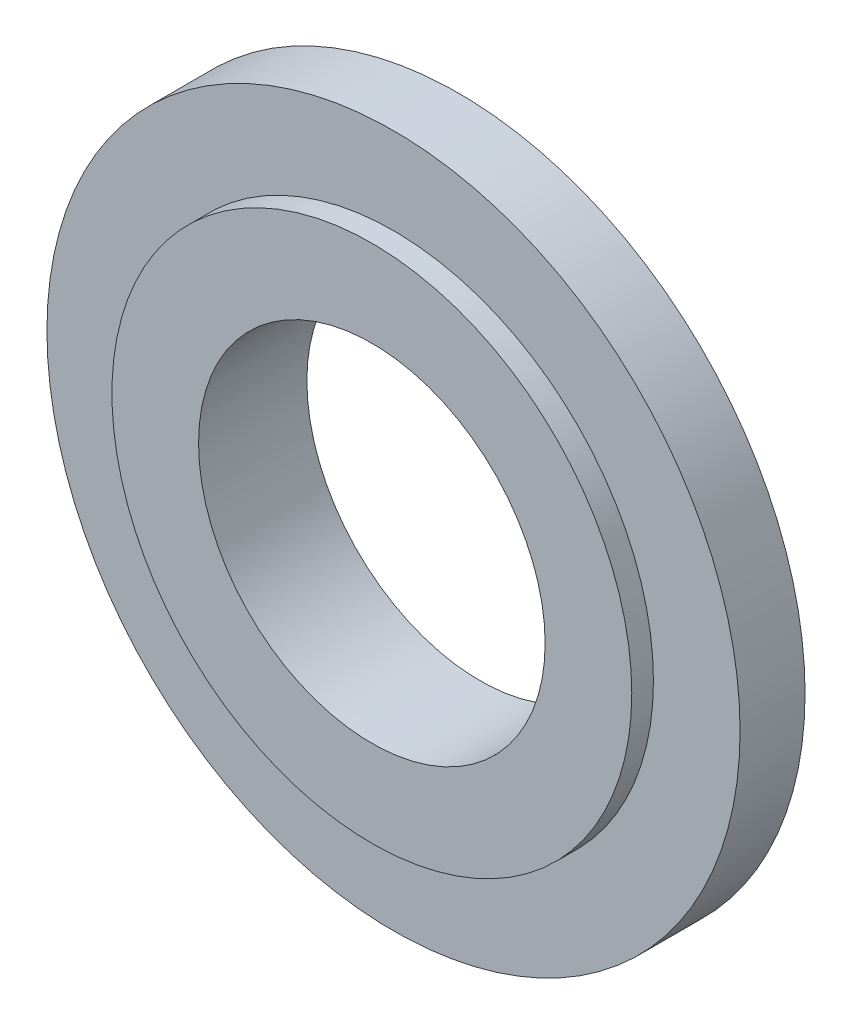
from build123d import *

# Parameters (mm, degrees)
SKETCH_1_R      = 8
SKETCH_1_R_2    = 4
EXTRUDE_1_DEPTH = 1.5
SKETCH_2_R      = 6
SKETCH_2_R_2    = 4
EXTRUDE_2_DEPTH = 0.5
EXTRUDE_START   = 0.5
SKETCH_3_R      = 6
SKETCH_3_R_2    = 4
EXTRUDE_3_DEPTH = 0.5


with BuildPart() as part:
    # Эскиз1 → Бобышка-Вытянуть1 (new body)
    with BuildSketch(Plane.XY):
        Circle(SKETCH_1_R)
        Circle(SKETCH_1_R_2, mode=Mode.SUBTRACT)
    extrude(amount=EXTRUDE_1_DEPTH)

    # Эскиз2 → Бобышка-Вытянуть2 (add)
    with BuildSketch(Plane.XY.offset(1.5)):
        Circle(SKETCH_2_R)
        Circle(SKETCH_2_R_2, mode=Mode.SUBTRACT)
    extrude(amount=EXTRUDE_2_DEPTH)

    # Эскиз3 → Бобышка-Вытянуть3 (add)
    with BuildSketch(Plane(origin=(0, 0, 0), x_dir=(-1, 0, 0), z_dir=(0, 0, -1)).offset(EXTRUDE_START)):
        with Locations(Location((0, 0, 0), (0, 0, 180))):
            Circle(SKETCH_3_R)
        Circle(SKETCH_3_R_2, mode=Mode.SUBTRACT)
    extrude(amount=-EXTRUDE_3_DEPTH)


solid = part.part
